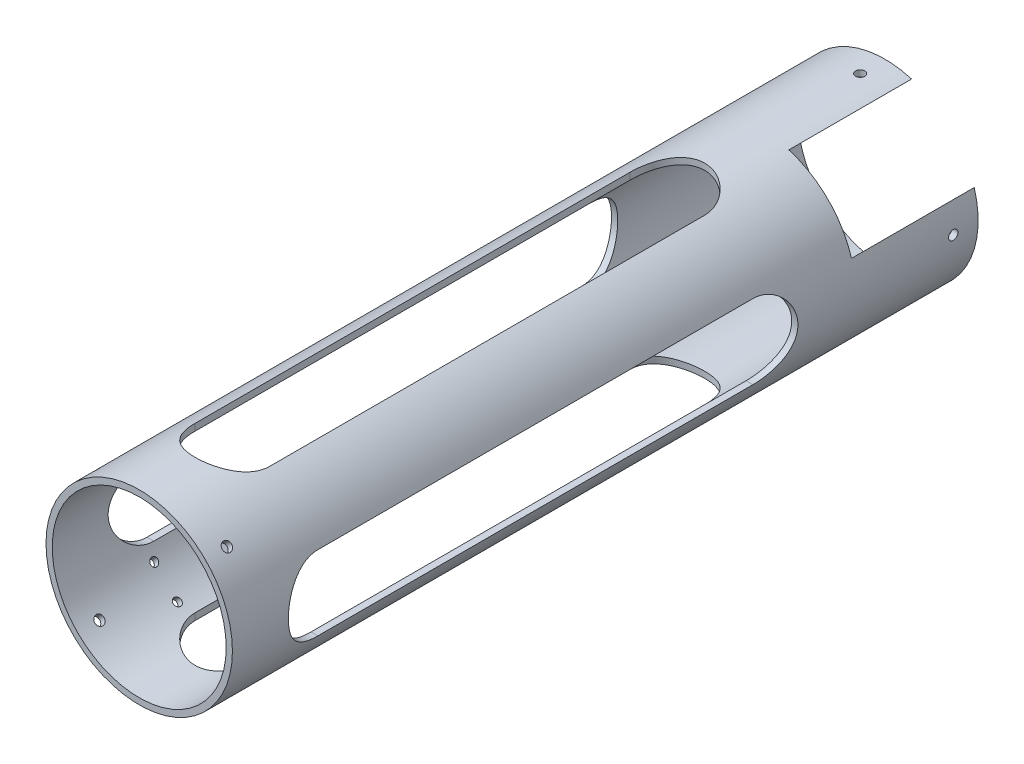
from build123d import *

# Parameters (mm, degrees)
SKETCH_1_R                = 30
SKETCH_1_R_2              = 28
EXTRUDE_1_DEPTH           = 240
SKETCH_2_W                = 39.5
SKETCH_2_H                = 28.5
CUT_EXTRUDE_1_DEPTH       = 50
CUT_EXTRUDE_2_DEPTH       = 249.112338834
CUT_EXTRUDE_2_DEPTH_BACK  = 249.112338834
SKETCH_3_R                = 1.5
CUT_EXTRUDE_3_DEPTH       = 251.690216165
CUT_EXTRUDE_3_DEPTH_BACK  = 251.690216165
SKETCH_4_R                = 1.5
SKETCH_10_R               = 1.25
CUT_EXTRUDE_6_DEPTH       = 32
CUT_EXTRUDE_8_DEPTH       = 247.373420534
CUT_EXTRUDE_8_DEPTH_BACK  = 6
SKETCH_12_R               = 1.25
SKETCH_16_R               = 1.500000001
CUT_EXTRUDE_9_DEPTH       = 257.04381459
SKETCH_17_R               = 1.5
CUT_EXTRUDE_10_DEPTH      = 257.043814593
CUT_EXTRUDE_14_DEPTH      = 244.721152264
CUT_EXTRUDE_14_DEPTH_BACK = 244.721152264
CUT_EXTRUDE_15_DEPTH      = 244.721152264
CUT_EXTRUDE_15_DEPTH_BACK = 244.721152264


with BuildPart() as part:
    # 스케치1 → 보스-돌출1 (new body)
    with BuildSketch(Plane.XY):
        Circle(SKETCH_1_R)
        Circle(SKETCH_1_R_2, mode=Mode.SUBTRACT)
    extrude(amount=EXTRUDE_1_DEPTH)

    # 스케치2 → 컷-돌출1 (cut)
    with BuildSketch(Plane(origin=(24.925514037, 24.925514037, 0), x_dir=(0, 0, -1), z_dir=(0.7071067811865538, 0.7071067811865414, 0))):
        with Locations((-19.75, 0)):
            Rectangle(SKETCH_2_W, SKETCH_2_H)
    extrude(amount=-CUT_EXTRUDE_1_DEPTH, mode=Mode.SUBTRACT)

    # 스케치3 → 컷-돌출2 (cut, two sides: drawn at the far end of the back side and taken through both)
    with BuildSketch(Plane(origin=(14.495689014, -14.495689014, 0), x_dir=(0, 0, -1), z_dir=(0.7071067811864803, -0.7071067811866147, 0)).offset(-CUT_EXTRUDE_2_DEPTH_BACK)):
        with Locations((-233, 0)):
            Circle(SKETCH_3_R)
    extrude(amount=CUT_EXTRUDE_2_DEPTH + CUT_EXTRUDE_2_DEPTH_BACK, mode=Mode.SUBTRACT)

    # 스케치4 → 컷-돌출3 (cut, two sides: drawn at the far end of the back side and taken through both)
    with BuildSketch(Plane(origin=(-21.213203436, -21.213203435, 0), x_dir=(0, 0, 1), z_dir=(-0.7071067811939012, -0.7071067811791938, 0)).offset(-CUT_EXTRUDE_3_DEPTH_BACK)):
        with Locations((233, 0)):
            Circle(SKETCH_4_R)
    extrude(amount=CUT_EXTRUDE_3_DEPTH + CUT_EXTRUDE_3_DEPTH_BACK, mode=Mode.SUBTRACT)

    # 스케치10 → 컷-돌출6 (cut)
    with BuildSketch(Plane(origin=(-9.369164851, -9.369164851, 0), x_dir=(0, 0, 1), z_dir=(-0.7071067811865538, -0.7071067811865414, 0))):
        with Locations((30, -5.25)):
            Circle(SKETCH_10_R)
        with Locations((30, 5.25)):
            Circle(SKETCH_10_R)
    extrude(amount=CUT_EXTRUDE_6_DEPTH, mode=Mode.SUBTRACT)

    # 스케치12 → 컷-돌출8 (cut, two sides: drawn at the far end of the back side and taken through both)
    with BuildSketch(Plane(origin=(-9.369164851, -9.369164851, 0), x_dir=(0, 0, 1), z_dir=(-0.7071067811865538, -0.7071067811865412, 0)).offset(-CUT_EXTRUDE_8_DEPTH_BACK)):
        with Locations((212, -5.25)):
            Circle(SKETCH_12_R)
        with Locations((212, 5.25)):
            Circle(SKETCH_12_R)
    extrude(amount=CUT_EXTRUDE_8_DEPTH + CUT_EXTRUDE_8_DEPTH_BACK, mode=Mode.SUBTRACT)

    # 스케치16 → 컷-돌출9 (cut, through all)
    with BuildSketch(Plane(origin=(-33.113425974, -33.048635025, 0), x_dir=(0.9999995205091545, -0.000979275988185722, 0), z_dir=(0.000979275988185722, 0.9999995205091546, 0))):
        with Locations((33.081046361, -8)):
            Circle(SKETCH_16_R)
    extrude(amount=CUT_EXTRUDE_9_DEPTH, mode=Mode.SUBTRACT)

    # 스케치17 → 컷-돌출10 (cut, through all)
    with BuildSketch(Plane(origin=(-33.113425974, -33.048635025, 0), x_dir=(0, 0, 1), z_dir=(-0.9999995205091546, 0.0009792759881857218, 0))):
        with Locations((8, 33.081046361)):
            Circle(SKETCH_17_R)
    extrude(amount=-CUT_EXTRUDE_10_DEPTH, mode=Mode.SUBTRACT)

    # 스케치24 → 컷-돌출14 (cut, two sides: drawn at the far end of the back side and taken through both)
    with BuildSketch(Plane(origin=(0, 0, 0), x_dir=(0, 0, -1), z_dir=(1, 0, 0)).offset(-CUT_EXTRUDE_14_DEPTH_BACK)):
        with BuildLine():
            Line((-210, 12), (-70, 12))
            ThreePointArc((-70, 12), (-58, 0), (-70, -12))
            Line((-70, -12), (-210, -12))
            ThreePointArc((-210, -12), (-222, 0), (-210, 12))
        make_face()
    extrude(amount=CUT_EXTRUDE_14_DEPTH + CUT_EXTRUDE_14_DEPTH_BACK, mode=Mode.SUBTRACT)

    # 스케치25 → 컷-돌출15 (cut, two sides: drawn at the far end of the back side and taken through both)
    with BuildSketch(Plane(origin=(0, 0, 0), x_dir=(1, 0, 0), z_dir=(0, 1, 0)).offset(-CUT_EXTRUDE_15_DEPTH_BACK)):
        with BuildLine():
            Line((-12, -210), (-12, -70))
            ThreePointArc((-12, -70), (0, -58), (12, -70))
            Line((12, -70), (12, -210))
            ThreePointArc((12, -210), (0, -222), (-12, -210))
        make_face()
    extrude(amount=CUT_EXTRUDE_15_DEPTH + CUT_EXTRUDE_15_DEPTH_BACK, mode=Mode.SUBTRACT)


solid = part.part
